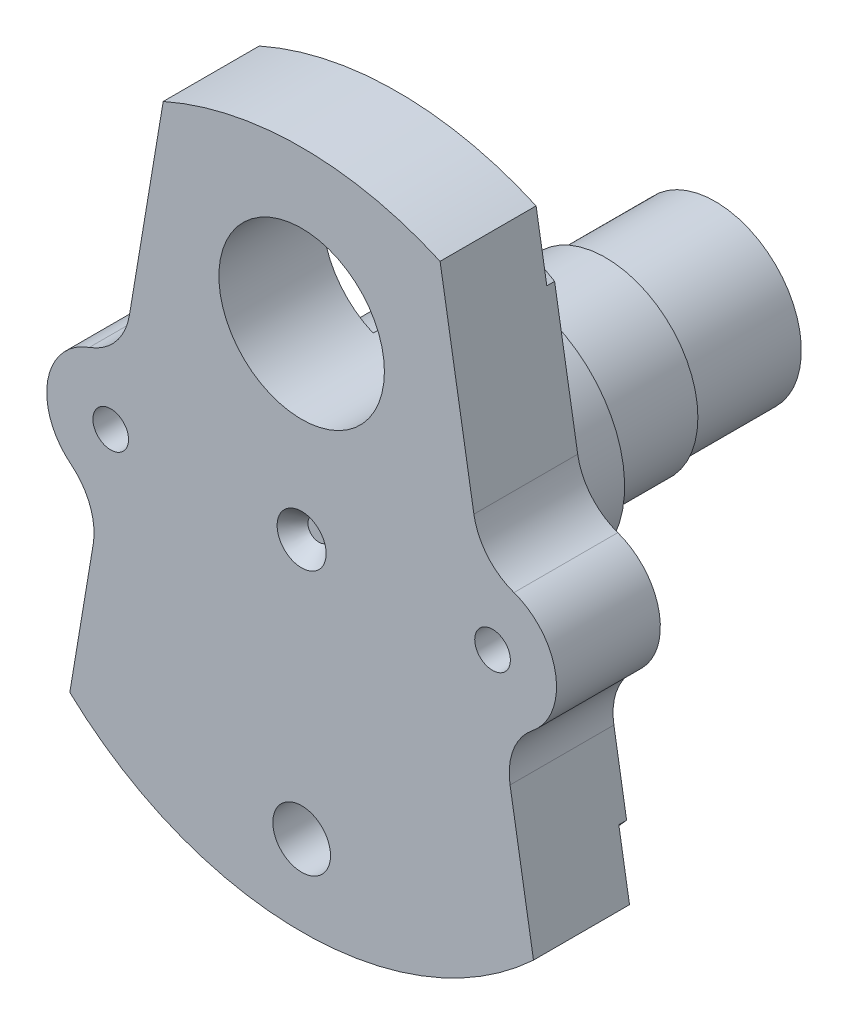
from build123d import *

# Parameters (mm, degrees)
SKETCH1_R           = 3.090826528
SKETCH1_R_2         = 14.35
SKETCH1_R_3         = 5
BOSS_EXTRUDE1_DEPTH = 18
SKETCH2_R           = 20
BOSS_EXTRUDE2_DEPTH = 18
SKETCH3_R           = 16
BOSS_EXTRUDE3_DEPTH = 35.7
SKETCH5_OUTSIDE_W   = 123.14
SKETCH5_OUTSIDE_H   = 152.554
SKETCH5_OUTSIDE_R   = 14.935
CUT_EXTRUDE1_DEPTH  = 19
SKETCH6_R           = 14.35
CUT_EXTRUDE2_DEPTH  = 22.35
SKETCH7_R           = 4.25
CUT_EXTRUDE3_DEPTH  = 3
CUT_EXTRUDE3_DRAFT  = -38
SKETCH9_OUTSIDE_W   = 123.14
SKETCH9_OUTSIDE_H   = 152.554
SKETCH9_OUTSIDE_R   = 49.923055682
CUT_EXTRUDE4_DEPTH  = 1.35


with BuildPart() as part:
    # Sketch1 → Boss-Extrude1 (new body)
    with BuildSketch(Plane.XY):
        with BuildLine():
            Line((36.136520686, -18.774478422), (40.195752281, -43.049171521))
            ThreePointArc((40.195752281, -43.049171521), (0, -58.897620241), (-40.195752281, -43.049171521))
            Line((-40.195752281, -43.049171521), (-36.136520686, -18.774478422))
            ThreePointArc((-36.136520686, -18.774478422), (-36.697665198, -13.197066935), (-40.010085223, -8.674868838))
            ThreePointArc((-40.010085223, -8.674868838), (-44.039037615, 1.827589449), (-36.814887741, 10.449987378))
            ThreePointArc((-36.814887741, 10.449987378), (-32.208677837, 13.651878045), (-29.862109135, 18.747257211))
            Line((-29.862109135, 18.747257211), (-24.003146652, 53.784557457))
            ThreePointArc((-24.003146652, 53.784557457), (0, 58.897620241), (24.003146652, 53.784557457))
            Line((24.003146652, 53.784557457), (29.862109135, 18.747257211))
            ThreePointArc((29.862109135, 18.747257211), (32.208677837, 13.651878045), (36.814887741, 10.449987378))
            ThreePointArc((36.814887741, 10.449987378), (44.039037615, 1.827589449), (40.010085223, -8.674868838))
            ThreePointArc((40.010085223, -8.674868838), (36.697665198, -13.197066935), (36.136520686, -18.774478422))
        make_face()
        with Locations((-33.1, 0)):
            Circle(SKETCH1_R, mode=Mode.SUBTRACT)
        with Locations(Location((33.1, 0, 0), (0, 0, 180))):
            Circle(SKETCH1_R, mode=Mode.SUBTRACT)
        with Locations((0, 32.4)):
            Circle(SKETCH1_R_2, mode=Mode.SUBTRACT)
        with Locations((0.004379967, -44.949999787)):
            Circle(SKETCH1_R_3, mode=Mode.SUBTRACT)
    extrude(amount=-BOSS_EXTRUDE1_DEPTH)

    # Sketch2 → Boss-Extrude2 (add)
    with BuildSketch(Plane(origin=(0, 0, -18), x_dir=(-1, 0, 0), z_dir=(0, 0, -1))):
        with Locations(Location((0, 0, 0), (0, 0, 106.311047481))):
            Circle(SKETCH2_R)
    extrude(amount=BOSS_EXTRUDE2_DEPTH)

    # Sketch3 → Boss-Extrude3 (add)
    with BuildSketch(Plane(origin=(0, 0, -36), x_dir=(-1, 0, 0), z_dir=(0, 0, -1))):
        with Locations(Location((0, 0, 0), (0, 0, 180))):
            Circle(SKETCH3_R)
    extrude(amount=BOSS_EXTRUDE3_DEPTH)

    # Sketch5 outside → Cut-Extrude1 (cut)
    with BuildSketch(Plane(origin=(0, 0, -71.7), x_dir=(-1, 0, 0), z_dir=(0, 0, -1))):
        Rectangle(SKETCH5_OUTSIDE_W, SKETCH5_OUTSIDE_H)
        Circle(SKETCH5_OUTSIDE_R, mode=Mode.SUBTRACT)
    extrude(amount=-CUT_EXTRUDE1_DEPTH, mode=Mode.SUBTRACT)

    # Sketch6 → Cut-Extrude2 (cut)
    with BuildSketch(Plane.XY):
        with Locations((0, 32.4)):
            Circle(SKETCH6_R)
    extrude(amount=-CUT_EXTRUDE2_DEPTH, mode=Mode.SUBTRACT)


with BuildPart() as cut_extrude3_tool:
    # Sketch7 → Cut-Extrude3 (with draft: the straight prism first)
    with BuildSketch(Plane.XY):
        Circle(SKETCH7_R)
    extrude(amount=-CUT_EXTRUDE3_DEPTH)
    # Cut-Extrude3: the draft: its side faces are tilted about the plane it starts from
    cut_extrude3_sides = [cut_extrude3_tool.faces().sort_by_distance(p)[0] for p in [
        (-4.25, 0, -1.5),
    ]]
    draft(cut_extrude3_sides, Plane.XY, CUT_EXTRUDE3_DRAFT)


with BuildPart() as part_1:
    add(part.part)

    # Cut-Extrude3: cut by cut_extrude3_tool
    add(cut_extrude3_tool.part, mode=Mode.SUBTRACT)

    # Sketch9 outside → Cut-Extrude4 (cut)
    with BuildSketch(Plane(origin=(0, 0, -18), x_dir=(-1, 0, 0), z_dir=(0, 0, -1))):
        Rectangle(SKETCH9_OUTSIDE_W, SKETCH9_OUTSIDE_H)
        Circle(SKETCH9_OUTSIDE_R, mode=Mode.SUBTRACT)
    extrude(amount=-CUT_EXTRUDE4_DEPTH, mode=Mode.SUBTRACT)


solid = part_1.part
